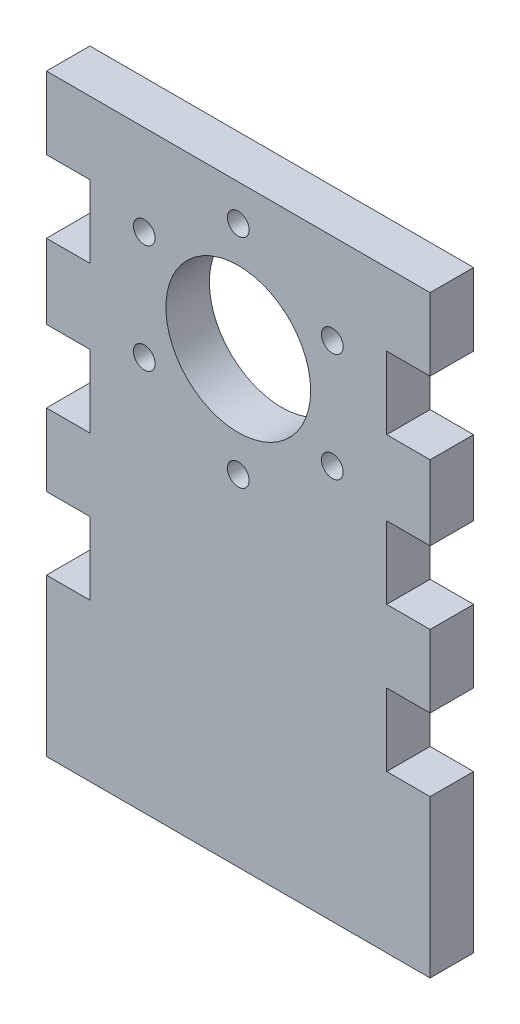
from build123d import *

# Parameters (mm, degrees)
SKETCH1_R           = 5
SKETCH1_R_2         = 0.75
BOSS_EXTRUDE1_DEPTH = 3


with BuildPart() as part:
    # Sketch1 → Boss-Extrude1 (new body)
    with BuildSketch(Plane.XY):
        Polygon((-13.25, 15.5), (-10.25, 15.5), (-10.25, 10.5), (-13.25, 10.5), (-13.25, 5.35), (-10.25, 5.35), (-10.25, 0.35), (-13.25, 0.35), (-13.25, -4.65), (-10.25, -4.65), (-10.25, -9.65), (-13.25, -9.65), (-13.25, -20.5), (13.25, -20.5), (13.25, -9.65), (10.25, -9.65), (10.25, -4.65), (13.25, -4.65), (13.25, 0.35), (10.25, 0.35), (10.25, 5.35), (13.25, 5.35), (13.25, 10.5), (10.25, 10.5), (10.25, 15.5), (13.25, 15.5), (13.25, 20.5), (-13.25, 20.5), align=None)
        with Locations((0, 10.5)):
            Circle(SKETCH1_R, mode=Mode.SUBTRACT)
        with Locations((0, 18)):
            Circle(SKETCH1_R_2, mode=Mode.SUBTRACT)
        with Locations((6.495302374, 14.249806272)):
            Circle(SKETCH1_R_2, mode=Mode.SUBTRACT)
        with Locations((6.495190528, 6.75)):
            Circle(SKETCH1_R_2, mode=Mode.SUBTRACT)
        with Locations((0, 3)):
            Circle(SKETCH1_R_2, mode=Mode.SUBTRACT)
        with Locations((-6.495302374, 6.750193728)):
            Circle(SKETCH1_R_2, mode=Mode.SUBTRACT)
        with Locations((-6.495190528, 14.25)):
            Circle(SKETCH1_R_2, mode=Mode.SUBTRACT)
    extrude(amount=BOSS_EXTRUDE1_DEPTH)


solid = part.part
